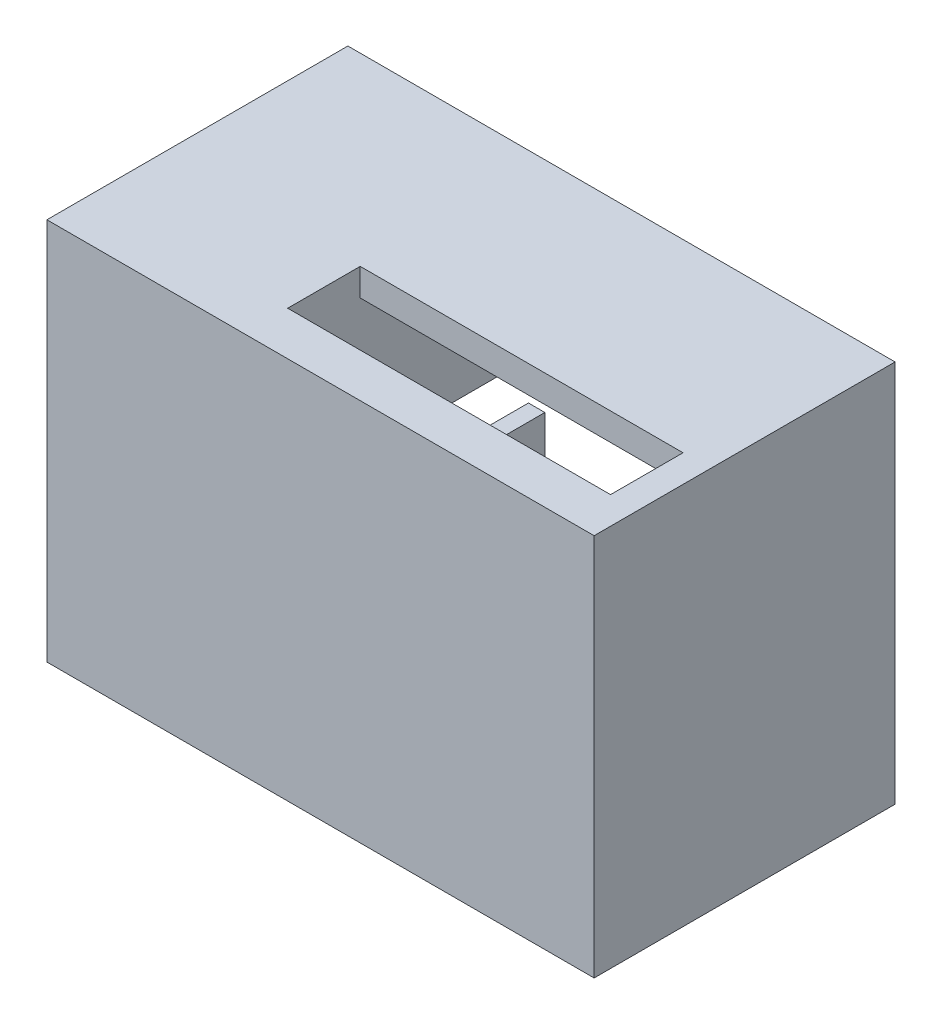
from build123d import *

# Parameters (mm, degrees)
BOSS_EXTRUDE1_DEPTH  = 60
CUT_EXTRUDE1_DEPTH   = 40
SKETCH11_W           = 2.5
SKETCH11_H           = 2.5
BOSS_EXTRUDE2_DEPTH  = 2.5
SKETCH14_W           = 3
SKETCH14_H           = 60
BOSS_EXTRUDE5_DEPTH  = 47
SKETCH12_R           = 1.125
BOSS_EXTRUDE3_DEPTH  = 6
CUT_EXTRUDE2_DEPTH   = 10
SKETCH16_W           = 100
SKETCH16_H           = 55
BOSS_EXTRUDE6_DEPTH  = 5
BOSS_EXTRUDE8_START  = -2
BOSS_EXTRUDE8_DEPTH  = 16
SKETCH19_W           = 2.25
SKETCH19_H           = 17
BOSS_EXTRUDE9_DEPTH  = 2.5
SKETCH20_W           = 100
SKETCH20_H           = 55
SKETCH20_W_2         = 59
SKETCH20_H_2         = 13.250841504
BOSS_EXTRUDE10_DEPTH = 5


with BuildPart() as part:
    # Sketch1 → Boss-Extrude1 (new body)
    with BuildSketch(Plane(origin=(0, 0, 0), x_dir=(1, 0, 0), z_dir=(0, 1, 0))):
        Polygon((40.01980198, -3.267326733), (40.01980198, 51.732673267), (35.01980198, 51.732673267), (35.01980198, 4.732673267), (-26.98019802, 4.732673267), (-26.98019802, 51.732673267), (-59.98019802, 51.732673267), (-59.98019802, -3.267326733), align=None)
    extrude(amount=BOSS_EXTRUDE1_DEPTH)

    # Sketch3 → Cut-Extrude1 (cut)
    with BuildSketch(Plane.ZY.offset(59.98019802)):
        with BuildLine():
            Line((-28.858094019, 44.125420752), (-51.732673267, 44.125420752))
            Line((-51.732673267, 44.125420752), (-51.732673267, 15.874579248))
            Line((-51.732673267, 15.874579248), (-28.858094019, 15.874579248))
            ThreePointArc((-28.858094019, 15.874579248), (-14.732673267, 30), (-28.858094019, 44.125420752))
        make_face()
    extrude(amount=-CUT_EXTRUDE1_DEPTH, mode=Mode.SUBTRACT)

    # Sketch11 → Boss-Extrude2 (add)
    with BuildSketch(Plane(origin=(0, 0, -14.732673267), x_dir=(-1, 0, 0), z_dir=(0, 0, -1))):
        with Locations((32.98019802, 30)):
            Rectangle(SKETCH11_W, SKETCH11_H)
    extrude(amount=BOSS_EXTRUDE2_DEPTH)

    # Sketch14 → Boss-Extrude5 (add)
    with BuildSketch(Plane(origin=(0, 0, -4.732673267), x_dir=(-1, 0, 0), z_dir=(0, 0, -1))):
        with Locations((25.48019802, 30)):
            Rectangle(SKETCH14_W, SKETCH14_H)
    extrude(amount=BOSS_EXTRUDE5_DEPTH)

    # Sketch12 → Boss-Extrude3 (add)
    with BuildSketch(Plane.ZY.offset(-35.01980198)):
        with Locations(Location((-36.858094019, 35.3, 0), (0, 0, 180))):
            Circle(SKETCH12_R)
        with Locations(Location((-36.858094019, 21.3, 0), (0, 0, 180))):
            Circle(SKETCH12_R)
    extrude(amount=BOSS_EXTRUDE3_DEPTH)

    # Sketch15 → Cut-Extrude2 (cut)
    with BuildSketch(Plane.ZY.offset(26.98019802)):
        with BuildLine():
            Line((-28.858094019, 35), (-51.732673267, 35))
            Line((-51.732673267, 35), (-51.732673267, 25))
            Line((-51.732673267, 25), (-28.858094019, 25))
            ThreePointArc((-28.858094019, 25), (-23.858094019, 30), (-28.858094019, 35))
        make_face()
    extrude(amount=-CUT_EXTRUDE2_DEPTH, mode=Mode.SUBTRACT)

    # Sketch16 → Boss-Extrude6 (add)
    with BuildSketch(Plane.XZ):
        with Locations((-9.98019802, -24.232673267)):
            Rectangle(SKETCH16_W, SKETCH16_H)
    extrude(amount=BOSS_EXTRUDE6_DEPTH)

    # Sketch18 → Boss-Extrude8 (add)
    with BuildSketch(Plane(origin=(0, 34.175, 0), x_dir=(-1, 0, 0), z_dir=(0, -1, 0)).offset(BOSS_EXTRUDE8_START)):
        Polygon((-35.01980198, 21.858094019), (-35.01980198, 9.965789174), (-29.01980198, 20.358094019), (-32.51980198, 20.358094019), (-32.51980198, 21.858094019), align=None)
    extrude(amount=BOSS_EXTRUDE8_DEPTH)

    # Sketch19 → Boss-Extrude9 (add)
    with BuildSketch(Plane.ZY.offset(-35.01980198)):
        with Locations((-36.858094019, 28.3)):
            Rectangle(SKETCH19_W, SKETCH19_H)
    extrude(amount=BOSS_EXTRUDE9_DEPTH)

    # Sketch20 → Boss-Extrude10 (add)
    with BuildSketch(Plane(origin=(0, 60, 0), x_dir=(1, 0, 0), z_dir=(0, 1, 0))):
        with Locations((-9.98019802, 24.232673267)):
            Rectangle(SKETCH20_W, SKETCH20_H)
        with Locations((5.51980198, 11.358094019)):
            Rectangle(SKETCH20_W_2, SKETCH20_H_2, mode=Mode.SUBTRACT)
    extrude(amount=BOSS_EXTRUDE10_DEPTH)


solid = part.part
